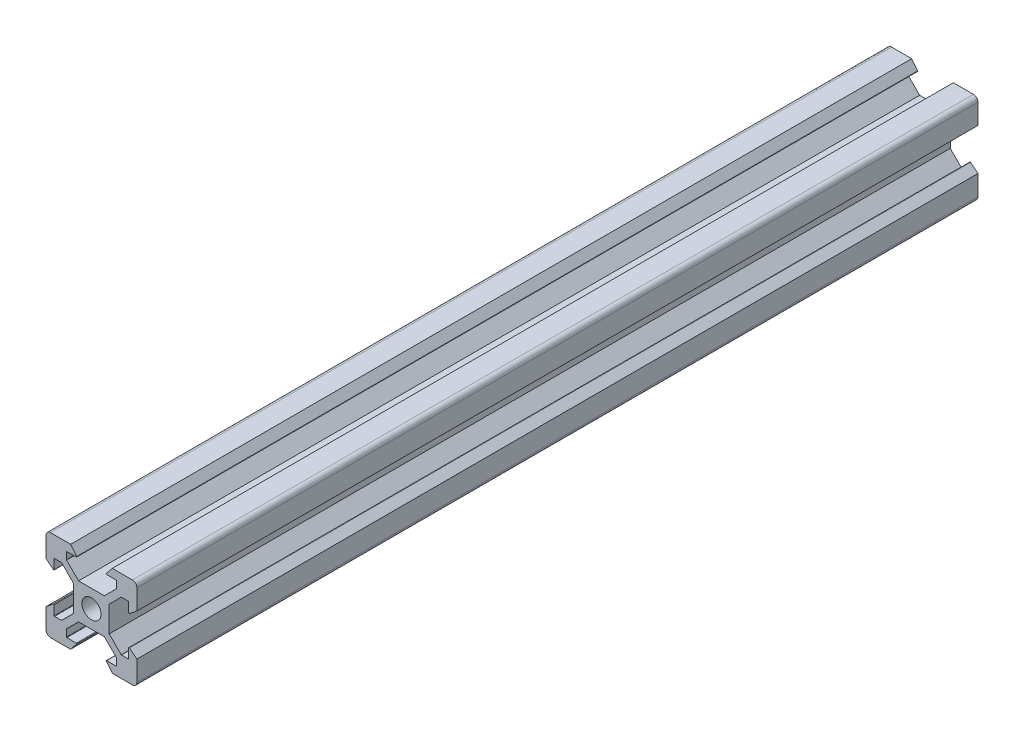
from build123d import *

# Parameters (mm, degrees)
SKETCH1_R           = 2.1
BOSS_EXTRUDE1_DEPTH = 185
FILLET1_R           = 1


with BuildPart() as part:
    # Sketch1 → Boss-Extrude1 (new body)
    with BuildSketch(Plane.XY):
        with BuildLine():
            Line((-2.839339828, 3.9), (-5.470710678, 6.53137085))
            ThreePointArc((-5.470710678, 6.53137085), (-5.492387953, 6.563813185), (-5.5, 6.602081528))
            Line((-5.5, 6.602081528), (-5.5, 8.1))
            ThreePointArc((-5.5, 8.1), (-5.470710678, 8.170710678), (-5.4, 8.2))
            Line((-5.4, 8.2), (-3.334418044, 8.2))
            ThreePointArc((-3.334418044, 8.2), (-3.244178397, 8.256909326), (-3.2566483, 8.362863876))
            Line((-3.2566483, 8.362863876), (-4.58, 10))
            Line((-4.58, 10), (-10, 10))
            Line((-10, 10), (-10, 4.58))
            Line((-10, 4.58), (-8.362863876, 3.2566483))
            ThreePointArc((-8.362863876, 3.2566483), (-8.256909326, 3.244178397), (-8.2, 3.334418044))
            Line((-8.2, 3.334418044), (-8.2, 5.4))
            ThreePointArc((-8.2, 5.4), (-8.170710678, 5.470710678), (-8.1, 5.5))
            Line((-8.1, 5.5), (-6.602081528, 5.5))
            ThreePointArc((-6.602081528, 5.5), (-6.563813185, 5.492387953), (-6.53137085, 5.470710678))
            Line((-6.53137085, 5.470710678), (-3.9, 2.839339828))
            Line((-3.9, 2.839339828), (-3.9, -2.839339828))
            Line((-3.9, -2.839339828), (-6.53137085, -5.470710678))
            ThreePointArc((-6.53137085, -5.470710678), (-6.563813185, -5.492387953), (-6.602081528, -5.5))
            Line((-6.602081528, -5.5), (-8.1, -5.5))
            ThreePointArc((-8.1, -5.5), (-8.170710678, -5.470710678), (-8.2, -5.4))
            Line((-8.2, -5.4), (-8.2, -3.334418044))
            ThreePointArc((-8.2, -3.334418044), (-8.256909326, -3.244178397), (-8.362863876, -3.2566483))
            Line((-8.362863876, -3.2566483), (-10, -4.58))
            Line((-10, -4.58), (-10, -10))
            Line((-10, -10), (-4.58, -10))
            Line((-4.58, -10), (-3.2566483, -8.362863876))
            ThreePointArc((-3.2566483, -8.362863876), (-3.244178397, -8.256909326), (-3.334418044, -8.2))
            Line((-3.334418044, -8.2), (-5.4, -8.2))
            ThreePointArc((-5.4, -8.2), (-5.470710678, -8.170710678), (-5.5, -8.1))
            Line((-5.5, -8.1), (-5.5, -6.602081528))
            ThreePointArc((-5.5, -6.602081528), (-5.492387953, -6.563813185), (-5.470710678, -6.53137085))
            Line((-5.470710678, -6.53137085), (-2.839339828, -3.9))
            Line((-2.839339828, -3.9), (2.839339828, -3.9))
            Line((2.839339828, -3.9), (5.470710678, -6.53137085))
            ThreePointArc((5.470710678, -6.53137085), (5.492387953, -6.563813185), (5.5, -6.602081528))
            Line((5.5, -6.602081528), (5.5, -8.1))
            ThreePointArc((5.5, -8.1), (5.470710678, -8.170710678), (5.4, -8.2))
            Line((5.4, -8.2), (3.334418044, -8.2))
            ThreePointArc((3.334418044, -8.2), (3.244178397, -8.256909326), (3.2566483, -8.362863876))
            Line((3.2566483, -8.362863876), (4.58, -10))
            Line((4.58, -10), (10, -10))
            Line((10, -10), (10, -4.58))
            Line((10, -4.58), (8.362863876, -3.2566483))
            ThreePointArc((8.362863876, -3.2566483), (8.256909326, -3.244178397), (8.2, -3.334418044))
            Line((8.2, -3.334418044), (8.2, -5.4))
            ThreePointArc((8.2, -5.4), (8.170710678, -5.470710678), (8.1, -5.5))
            Line((8.1, -5.5), (6.602081528, -5.5))
            ThreePointArc((6.602081528, -5.5), (6.563813185, -5.492387953), (6.53137085, -5.470710678))
            Line((6.53137085, -5.470710678), (3.9, -2.839339828))
            Line((3.9, -2.839339828), (3.9, 2.839339828))
            Line((3.9, 2.839339828), (6.53137085, 5.470710678))
            ThreePointArc((6.53137085, 5.470710678), (6.563813185, 5.492387953), (6.602081528, 5.5))
            Line((6.602081528, 5.5), (8.1, 5.5))
            ThreePointArc((8.1, 5.5), (8.170710678, 5.470710678), (8.2, 5.4))
            Line((8.2, 5.4), (8.2, 3.334418044))
            ThreePointArc((8.2, 3.334418044), (8.256909326, 3.244178397), (8.362863876, 3.2566483))
            Line((8.362863876, 3.2566483), (10, 4.58))
            Line((10, 4.58), (10, 10))
            Line((10, 10), (4.58, 10))
            Line((4.58, 10), (3.2566483, 8.362863876))
            ThreePointArc((3.2566483, 8.362863876), (3.244178397, 8.256909326), (3.334418044, 8.2))
            Line((3.334418044, 8.2), (5.4, 8.2))
            ThreePointArc((5.4, 8.2), (5.470710678, 8.170710678), (5.5, 8.1))
            Line((5.5, 8.1), (5.5, 6.602081528))
            ThreePointArc((5.5, 6.602081528), (5.492387953, 6.563813185), (5.470710678, 6.53137085))
            Line((5.470710678, 6.53137085), (2.839339828, 3.9))
            Line((2.839339828, 3.9), (-2.839339828, 3.9))
        make_face()
        Circle(SKETCH1_R, mode=Mode.SUBTRACT)
    extrude(amount=BOSS_EXTRUDE1_DEPTH)

    # Fillet1
    fillet1_edges = [part.edges().sort_by_distance(p)[0] for p in [
        (10, -10, 92.5),
        (-10, -10, 92.5),
        (-10, 10, 92.5),
        (10, 10, 92.5),
    ]]
    fillet(fillet1_edges, radius=FILLET1_R)


solid = part.part
